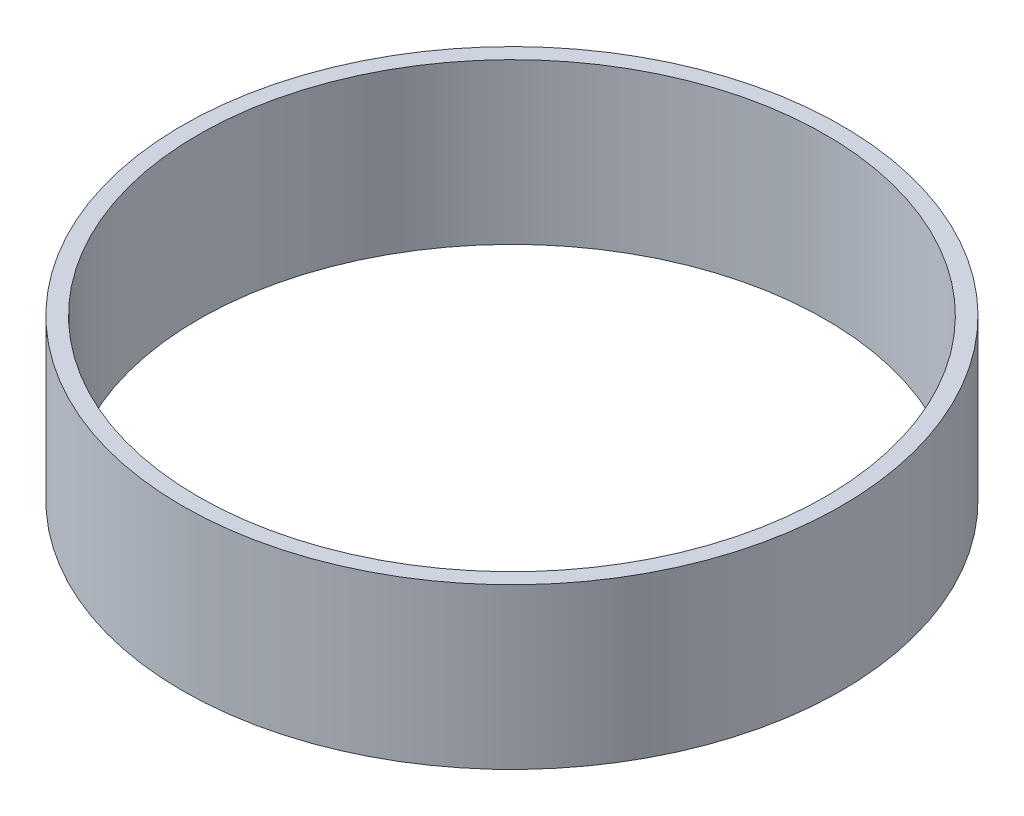
from build123d import *

# Parameters (mm, degrees)
SKETCH1_R           = 41.2
SKETCH1_R_2         = 39.2
BOSS_EXTRUDE1_DEPTH = 20


with BuildPart() as part:
    # Sketch1 → Boss-Extrude1 (new body)
    with BuildSketch(Plane(origin=(0, 0, 0), x_dir=(1, 0, 0), z_dir=(0, 1, 0))):
        with Locations(Location((0, 0, 0), (0, 0, 270))):
            Circle(SKETCH1_R)
        with Locations(Location((0, 0, 0), (0, 0, 270))):
            Circle(SKETCH1_R_2, mode=Mode.SUBTRACT)
    extrude(amount=BOSS_EXTRUDE1_DEPTH)


solid = part.part
